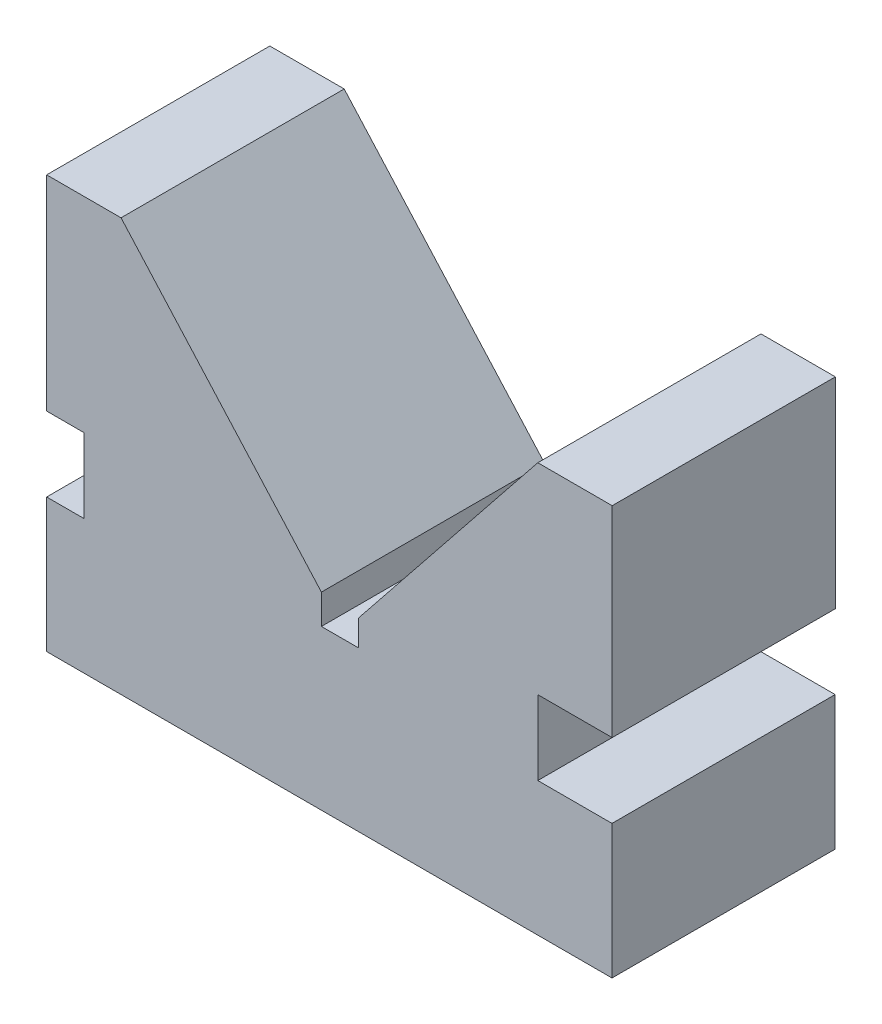
from build123d import *

# Parameters (mm, degrees)
BOSS_EXTRUDE1_DEPTH = 30


with BuildPart() as part:
    # Sketch1 → Boss-Extrude1 (new body)
    with BuildSketch(Plane.XY):
        Polygon((0, 0), (76, 0), (76, 18), (66.023866348, 18), (66.023866348, 28), (76.023866348, 28), (76.023866348, 55), (66.023866348, 55), (41.935560859, 24.890214797), (41.935560859, 21.393794749), (36.935560859, 21.393794749), (36.935560859, 25.393794749), (10, 55.503579952), (0, 55.503579952), (0, 28), (5, 28), (5, 18), (0, 18), align=None)
    extrude(amount=BOSS_EXTRUDE1_DEPTH)


solid = part.part
